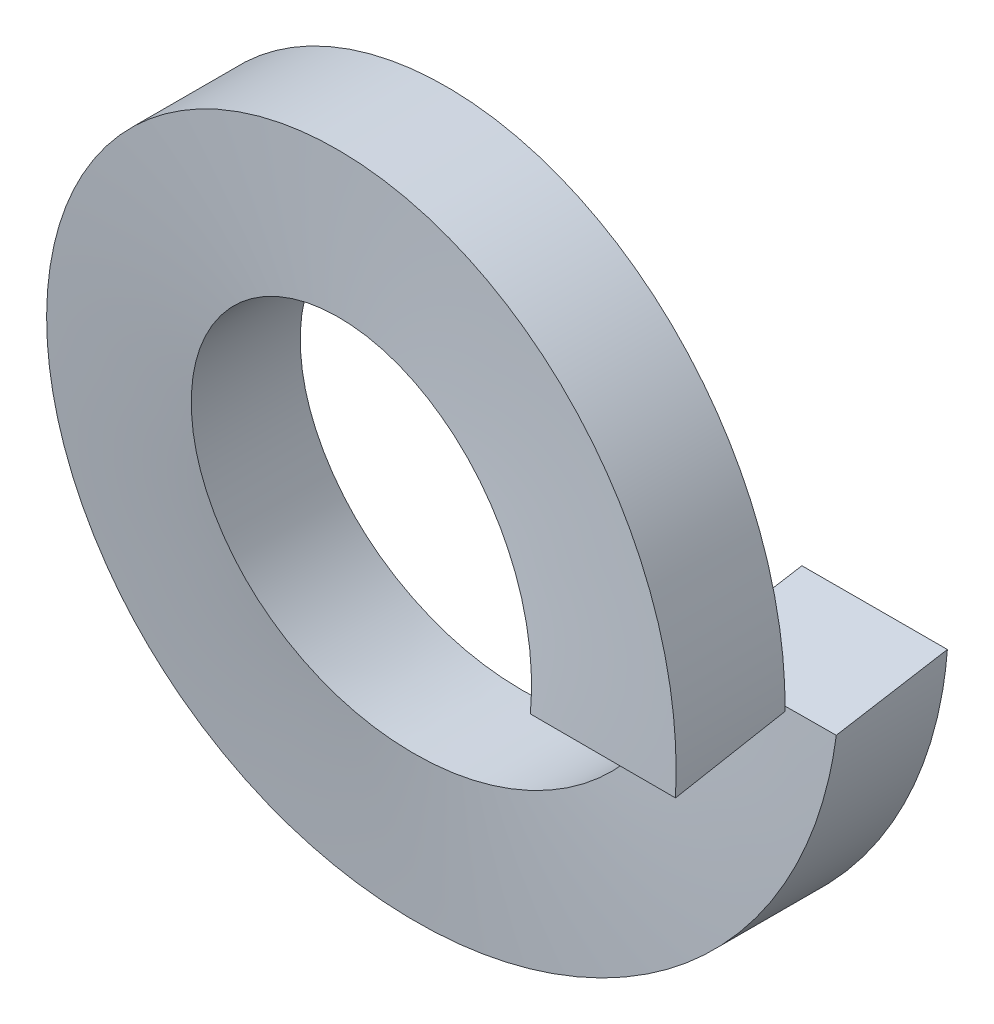
from build123d import *

# Parameters (mm, degrees)
SWEEP_1_PITCH       = 4.5
SWEEP_1_HEIGHT      = 4.5
SWEEP_1_RADIUS      = 9.765
SWEEP_1_START_ANGLE = -180
SKETCH_4_W          = 4
SKETCH_4_H          = 3
CUT_EXTRUDE_2_DEPTH = 15.309889709


with BuildPart() as part:
    # 扫描1: sweep along a helix
    with BuildLine() as sweep_1_path:
        add(Helix(SWEEP_1_PITCH, SWEEP_1_HEIGHT, SWEEP_1_RADIUS, center=(0, 0, 3.75), direction=(0, 0, -1), lefthand=True, mode=Mode.PRIVATE).rotate(Axis((0, 0, 3.75), (0, 0, -1)), SWEEP_1_START_ANGLE))
    # 草图4 → 扫描1 (sweep)
    with BuildSketch(Plane(origin=(0, 0, 0), x_dir=(1, 0, 0), z_dir=(0, 1, 0))):
        with Locations((7.765, -2.25)):
            Rectangle(SKETCH_4_W, SKETCH_4_H)
    sweep(path=sweep_1_path.line, is_frenet=True)

    # 草图5 → 切除-拉伸2 (cut, through all)
    with BuildSketch(Plane(origin=(0, 0, 0), x_dir=(0, 0, -1), z_dir=(1, 0, 0))):
        Polygon((-7.5, -0.560882396), (7.5, 2.084022314), (7.760472267, 0.606810685), (-7.239527733, -2.038094026), align=None)
    extrude(amount=CUT_EXTRUDE_2_DEPTH, mode=Mode.SUBTRACT)


solid = part.part
